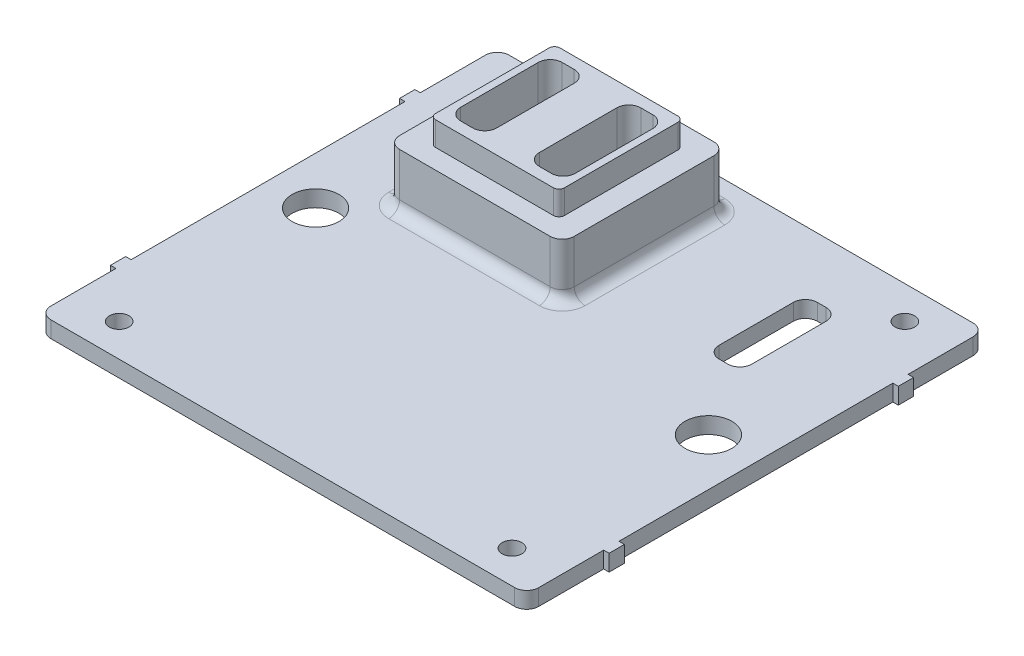
from build123d import *

# Parameters (mm, degrees)
EXTRUDE_1_DEPTH     = 1.5
SKETCH_2_R          = 2.15
SKETCH_2_R_2        = 0.9
CUT_EXTRUDE_1_DEPTH = 32.070444155
SKETCH_3_W          = 12.2
SKETCH_3_H          = 12
EXTRUDE_2_DEPTH     = 7.2
SKETCH_4_W          = 16
SKETCH_4_H          = 15
EXTRUDE_3_DEPTH     = 7.2
SKETCH_5_W          = 3.3
SKETCH_5_H          = 9.3
CUT_EXTRUDE_2_DEPTH = 33.230614329
SKETCH_6_W          = 5.4
SKETCH_6_H          = 12.4
CUT_EXTRUDE_3_DEPTH = 2.7
SKETCH_7_W          = 3
SKETCH_7_H          = 9
CUT_EXTRUDE_4_DEPTH = 33.230614329
SKETCH_8_W          = 16
SKETCH_8_H          = 15
SKETCH_8_W_2        = 11.8
SKETCH_8_H_2        = 11.4
CUT_EXTRUDE_5_DEPTH = 2.2
FILLET_1_R          = 1.1
FILLET_2_R          = 0.5
FILLET_3_R          = 1
CHAMFER_1_SIZE      = 0.4


with BuildPart() as part:
    # 草图1 → 凸台-拉伸1 (new body)
    with BuildSketch(Plane(origin=(0, 0, 0), x_dir=(1, 0, 0), z_dir=(0, 1, 0))):
        Polygon((-22.35, -12.55), (-22.85, -12.55), (-22.85, -13.95), (-22.35, -13.95), (-22.35, -21), (22.35, -21), (22.35, -13.95), (22.85, -13.95), (22.85, -12.55), (22.35, -12.55), (22.35, 12.55), (22.85, 12.55), (22.85, 13.95), (22.35, 13.95), (22.35, 21), (-22.35, 21), (-22.35, 13.95), (-22.85, 13.95), (-22.85, 12.55), (-22.35, 12.55), align=None)
    extrude(amount=EXTRUDE_1_DEPTH)

    # 草图2 → 切除-拉伸1 (cut, through all)
    with BuildSketch(Plane(origin=(0, 1.5, 0), x_dir=(1, 0, 0), z_dir=(0, 1, 0))):
        with Locations(Location((-18, 0, 0), (0, 0, 270))):
            Circle(SKETCH_2_R)
        with Locations(Location((18, 0, 0), (0, 0, 270))):
            Circle(SKETCH_2_R)
        with Locations(Location((-18, -18, 0), (0, 0, 270))):
            Circle(SKETCH_2_R_2)
        with Locations(Location((-18, 18, 0), (0, 0, 270))):
            Circle(SKETCH_2_R_2)
        with Locations(Location((18, -18, 0), (0, 0, 90))):
            Circle(SKETCH_2_R_2)
        with Locations(Location((18, 18, 0), (0, 0, 90))):
            Circle(SKETCH_2_R_2)
    extrude(amount=-CUT_EXTRUDE_1_DEPTH, mode=Mode.SUBTRACT)

    # 草图3 → 凸台-拉伸2 (add)
    with BuildSketch(Plane(origin=(0, 1.5, 0), x_dir=(1, 0, 0), z_dir=(0, 1, 0))):
        with Locations((-6.9, 11)):
            Rectangle(SKETCH_3_W, SKETCH_3_H)
    extrude(amount=EXTRUDE_2_DEPTH)

    # 草图4 → 凸台-拉伸3 (add)
    with BuildSketch(Plane(origin=(0, 1.5, 0), x_dir=(1, 0, 0), z_dir=(0, 1, 0))):
        with Locations((-6.9, 11)):
            Rectangle(SKETCH_4_W, SKETCH_4_H)
    extrude(amount=EXTRUDE_3_DEPTH)

    # 草图5 → 切除-拉伸2 (cut, through all)
    with BuildSketch(Plane(origin=(0, 8.7, 0), x_dir=(1, 0, 0), z_dir=(0, 1, 0))):
        with Locations((-10.5, 11)):
            Rectangle(SKETCH_5_W, SKETCH_5_H)
        with Locations((-3.3, 11)):
            Rectangle(SKETCH_5_W, SKETCH_5_H)
    extrude(amount=-CUT_EXTRUDE_2_DEPTH, mode=Mode.SUBTRACT)

    # 草图6 → 切除-拉伸3 (cut)
    with BuildSketch(Plane.XZ):
        with Locations((-10.5, -11)):
            Rectangle(SKETCH_6_W, SKETCH_6_H)
        with Locations((-3.3, -11)):
            Rectangle(SKETCH_6_W, SKETCH_6_H)
    extrude(amount=-CUT_EXTRUDE_3_DEPTH, mode=Mode.SUBTRACT)

    # 草图7 → 切除-拉伸4 (cut, through all)
    with BuildSketch(Plane.XZ):
        with Locations((12.88, -11)):
            Rectangle(SKETCH_7_W, SKETCH_7_H)
    extrude(amount=-CUT_EXTRUDE_4_DEPTH, mode=Mode.SUBTRACT)

    # 草图8 → 切除-拉伸5 (cut)
    with BuildSketch(Plane(origin=(0, 8.7, 0), x_dir=(1, 0, 0), z_dir=(0, 1, 0))):
        with Locations((-6.9, 11)):
            Rectangle(SKETCH_8_W, SKETCH_8_H)
        with Locations((-6.9, 11)):
            Rectangle(SKETCH_8_W_2, SKETCH_8_H_2, mode=Mode.SUBTRACT)
    extrude(amount=-CUT_EXTRUDE_5_DEPTH, mode=Mode.SUBTRACT)

    # 圆角1
    fillet_1_edges = [part.edges().sort_by_distance(p)[0] for p in [
        (-12.15, 5.7, -15.65),
        (-8.85, 5.7, -15.65),
        (-12.15, 5.7, -6.35),
        (-8.85, 5.7, -6.35),
        (-4.95, 5.7, -15.65),
        (-1.65, 5.7, -15.65),
        (-4.95, 5.7, -6.35),
        (-1.65, 5.7, -6.35),
        (14.38, 0.75, -6.5),
        (14.38, 0.75, -15.5),
        (11.38, 0.75, -15.5),
        (11.38, 0.75, -6.5),
        (-14.9, 4, -3.5),
        (1.1, 4, -3.5),
        (-14.9, 4, -18.5),
        (1.1, 4, -18.5),
        (22.35, 0.75, 21),
        (-22.35, 0.75, 21),
        (-22.35, 0.75, -21),
        (22.35, 0.75, -21),
    ]]
    fillet(fillet_1_edges, radius=FILLET_1_R)

    # 圆角2
    fillet_2_edges = [part.edges().sort_by_distance(p)[0] for p in [
        (-1, 7.6, -5.3),
        (-12.8, 7.6, -5.3),
        (-12.8, 7.6, -16.7),
        (-1, 7.6, -16.7),
    ]]
    fillet(fillet_2_edges, radius=FILLET_2_R)

    # 圆角3
    fillet_3_edges = [part.edges().sort_by_distance(p)[0] for p in [
        (-6.9, 1.5, -18.5),
        (1.1, 1.5, -11),
        (-6.9, 1.5, -3.5),
        (-14.9, 1.5, -11),
        (-14.577817459, 1.5, -3.822182541),
        (-14.577817459, 1.5, -18.177817459),
        (0.777817459, 1.5, -18.177817459),
        (0.777817459, 1.5, -3.822182541),
    ]]
    fillet(fillet_3_edges, radius=FILLET_3_R)

    # 倒角1
    chamfer_1_edges = [part.edges().sort_by_distance(p)[0] for p in [
        (-7.8, 1.35, -4.8),
        (-7.8, 1.35, -17.2),
        (-13.2, 1.35, -17.2),
        (-13.2, 1.35, -4.8),
        (-0.6, 1.35, -4.8),
        (-0.6, 1.35, -17.2),
        (-6, 1.35, -17.2),
        (-6, 1.35, -4.8),
    ]]
    chamfer(chamfer_1_edges, length=CHAMFER_1_SIZE)


solid = part.part
